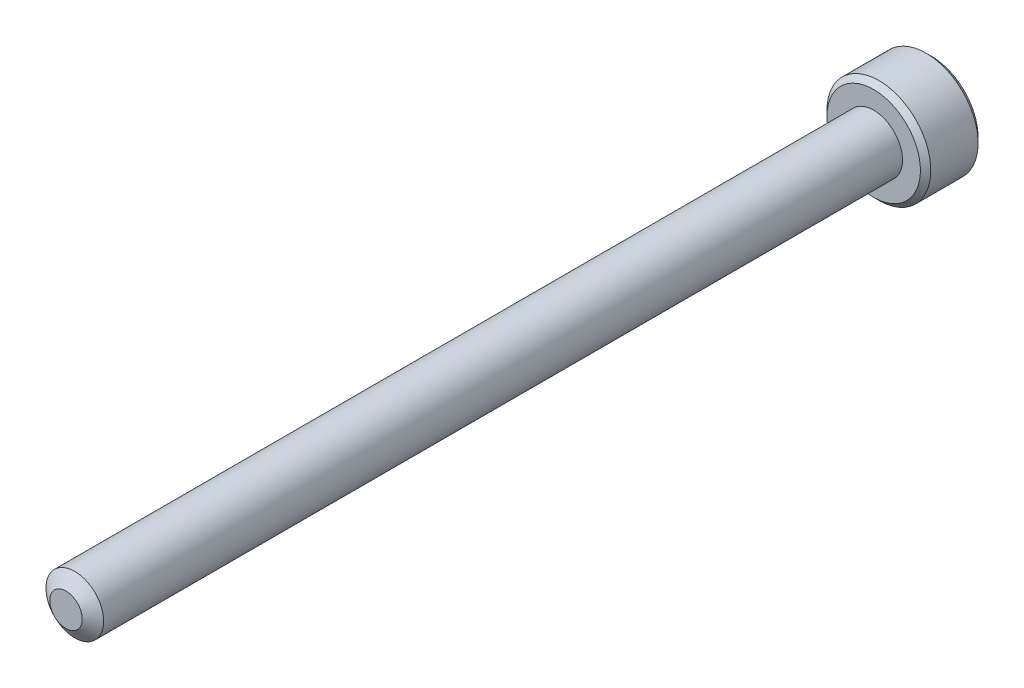
from build123d import *

# Parameters (mm, degrees)
SKETCH1_R          = 1.25
EXTRUDE1_DEPTH     = 35
SKETCH6_R          = 2.25
EXTRUDE2_DEPTH     = 2.5
CUT_EXTRUDE1_DEPTH = 1.5
CHAMFER1_SIZE      = 0.225


with BuildPart() as part:
    # Sketch1 → Extrude1 (new body)
    with BuildSketch(Plane.XY):
        Circle(SKETCH1_R)
    extrude(amount=-EXTRUDE1_DEPTH)

    # Sketch4 → Cut-Revolve1 (revolve, cut)
    with BuildSketch(Plane(origin=(0, 0, 0), x_dir=(0, 0, -1), z_dir=(1, 0, 0))):
        Polygon((0.382511876, 1.25), (0, 0.703716426), (0, 1.25), align=None)
    revolve(axis=Axis((0, 0, 0), (0, 0, -1)), mode=Mode.SUBTRACT)

    # Sketch6 → Extrude2 (add)
    with BuildSketch(Plane(origin=(0, 0, -35), x_dir=(-1, 0, 0), z_dir=(0, 0, -1))):
        Circle(SKETCH6_R)
    extrude(amount=EXTRUDE2_DEPTH)

    # Sketch7 → Cut-Extrude1 (cut)
    with BuildSketch(Plane(origin=(0, 0, -37.5), x_dir=(-1, 0, 0), z_dir=(0, 0, -1))):
        Polygon((0, 1.154700538), (-1, 0.577350269), (-1, -0.577350269), (0, -1.154700538), (1, -0.577350269), (1, 0.577350269), align=None)
    extrude(amount=-CUT_EXTRUDE1_DEPTH, mode=Mode.SUBTRACT)

    # Cut-Extrude2 cone 1 section (through the dimple's axis) → Cut-Extrude2 (revolve, cut)
    with BuildSketch(Plane(origin=(0, 0, -37.5), x_dir=(0, 1, 0), z_dir=(1, 0, 0))):
        Polygon((0, 0), (1.154700538, 0), (0, 1.154700538), align=None)
    revolve(axis=Axis((0, 0, -37.5), (0, 0, 1)), mode=Mode.SUBTRACT)

    # Chamfer1
    chamfer1_edges = [part.edges().sort_by_distance(p)[0] for p in [
        (2.25, 0, -37.5),
        (2.25, 0, -35),
    ]]
    chamfer(chamfer1_edges, length=CHAMFER1_SIZE)


solid = part.part
